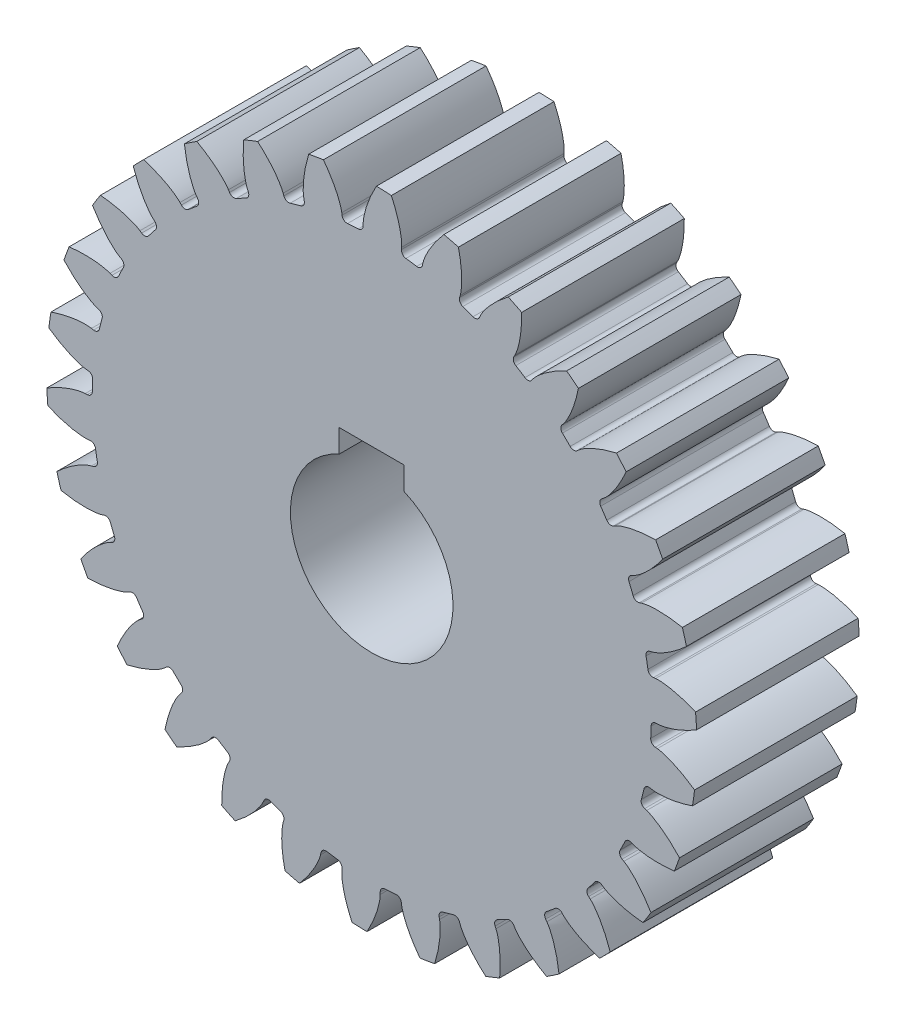
from build123d import *

# Parameters (mm, degrees)
SKETCH_1_R                       = 40
EXTRUDE_1_DEPTH                  = 20
CUT_EXTRUDE_1_DEPTH              = 61
FILLET_1_R                       = 0.625
PATTERN_CIRCULAR_1_COUNT         = 30
FILLET_1_OF_PATTERN_CIRCULAR_1_R = 0.625
CUT_EXTRUDE_2_DEPTH              = 60.97116839


with BuildPart() as part:
    # 草图1 → 凸台-拉伸1 (new body)
    with BuildSketch(Plane.XY):
        Circle(SKETCH_1_R)
    extrude(amount=EXTRUDE_1_DEPTH)

    # 草图2 → 切除-拉伸1 (cut, through all)
    with BuildSketch(Plane(origin=(0, 0, 0), x_dir=(-1, 0, 0), z_dir=(0, 0, -1))):
        with BuildLine():
            Line((-35.238473279, 0), (-34.374995165, -0.018231187))
            ThreePointArc((-34.374995165, -0.018231187), (-34.350890182, -1.287232965), (-34.279954168, -2.554479841))
            Line((-34.279954168, -2.554479841), (-35.139646197, -2.637283486))
            add(Edge.make_bspline(
                [(-35.139646197, -2.637283486), (-35.165583876, -2.639781746), (-35.238148262, -2.64849253), (-35.374524812, -2.671641963), (-35.595423661, -2.718865499), (-35.874105652, -2.792799504), (-36.230455076, -2.9040601), (-36.644621455, -3.055040806), (-37.093151943, -3.241691998), (-37.573073419, -3.466609592), (-38.04426973, -3.710342163), (-38.506447974, -3.970769709), (-38.959752886, -4.246290712), (-39.31743129, -4.479128313), (-39.560427626, -4.644854401), (-39.692816711, -4.737382216), (-39.716488956, -4.753998843)],
                knots=[0, 0, 0, 0, 0, 0.005376748, 0.015083688, 0.02853182, 0.046610139, 0.064854849, 0.092110525, 0.119476175, 0.146842495, 0.174208853, 0.201574955, 0.228941013, 0.256307345, 0.26227653, 0.26227653, 0.26227653, 0.26227653, 0.26227653], degree=4))
            ThreePointArc((-39.716488956, -4.753998843), (-39.971944939, -1.497871087), (-39.960897329, 1.768243375))
            add(Edge.make_bspline(
                [(-35.238473279, 0), (-35.264525188, 0.000550051), (-35.33753799, 0.003805612), (-35.475264596, 0.016683561), (-35.699078187, 0.047242362), (-35.982511904, 0.100112171), (-36.346188796, 0.184391177), (-36.770493187, 0.303951819), (-37.231734928, 0.456511062), (-37.727143517, 0.644880053), (-38.215259543, 0.852664256), (-38.695632262, 1.077771533), (-39.168286145, 1.318594026), (-39.542387237, 1.524009611), (-39.797105195, 1.671084821), (-39.936047869, 1.753445005), (-39.960897329, 1.768243375)],
                knots=[0, 0, 0, 0, 0, 0.005376748, 0.015083688, 0.02853182, 0.046610139, 0.064854849, 0.092110525, 0.119476175, 0.146842495, 0.174208853, 0.201574955, 0.228941013, 0.256307345, 0.26227653, 0.26227653, 0.26227653, 0.26227653, 0.26227653], degree=4))
        make_face()
    cut_extrude_1 = extrude(amount=-CUT_EXTRUDE_1_DEPTH, mode=Mode.SUBTRACT)

    # 圆角1
    fillet_1_edges = [part.edges().sort_by_distance(p)[0] for p in [
        (34.374995165, -0.018231187, 10),
        (34.279954168, -2.554479841, 10),
    ]]
    fillet(fillet_1_edges, radius=FILLET_1_R)

    # 阵列(圆周)1: 切除-拉伸1 ×30 about axis
    pattern_circular_1_axis = Axis((0, 0, 20), (0, 0, -1))
    for i in range(1, PATTERN_CIRCULAR_1_COUNT):
        add(cut_extrude_1.rotate(pattern_circular_1_axis, i * 360 / PATTERN_CIRCULAR_1_COUNT), mode=Mode.SUBTRACT)

    # 圆角1 of 阵列(圆周)1
    fillet_1_of_pattern_circular_1_edges = [part.edges().sort_by_distance(p)[0] for p in [
        (33.620028569, -7.164796159, 10),
        (32.9997487, -9.625861559, 10),
        (31.395705398, -13.998225158, 10),
        (30.277295863, -16.276546938, 10),
        (27.799239247, -20.219864546, 10),
        (26.23157991, -22.215869112, 10),
        (22.987812946, -25.557798828, 10),
        (21.039418043, -27.184251202, 10),
        (17.171708911, -29.778734662, 10),
        (14.927732648, -30.96455107, 10),
        (10.605118798, -32.698196896, 10),
        (8.163633706, -33.391551472, 10),
        (3.575034105, -34.188591023, 10),
        (1.042744797, -34.359180844, 10),
        (-3.611296734, -34.184779667, 10),
        (-6.123717063, -33.82514914, 10),
        (-10.639796577, -32.686929403, 10),
        (-13.022543102, -31.812796107, 10),
        (-17.203286254, -29.760503475, 10),
        (-19.352221519, -28.410071229, 10),
        (-23.014909771, -25.533400738, 10),
        (-24.836114994, -23.765689913, 10),
        (-27.820671293, -20.190365866, 10),
        (-29.234551066, -18.082633906, 10),
        (-31.410535982, -13.964915121, 10),
        (-32.355296973, -11.609280028, 10),
        (-33.627609523, -7.129130575, 10),
        (-34.061961145, -4.628544905, 10),
        (-34.374995165, 0.018231187, 10),
        (-34.279954168, 2.554479841, 10),
        (-33.620028569, 7.164796159, 10),
        (-32.9997487, 9.625861559, 10),
        (-31.395705398, 13.998225158, 10),
        (-30.277295863, 16.276546938, 10),
        (-27.799239247, 20.219864546, 10),
        (-26.23157991, 22.215869112, 10),
        (-22.987812946, 25.557798828, 10),
        (-21.039418043, 27.184251202, 10),
        (-17.171708911, 29.778734662, 10),
        (-14.927732648, 30.96455107, 10),
        (-10.605118798, 32.698196896, 10),
        (-8.163633706, 33.391551472, 10),
        (-3.575034105, 34.188591023, 10),
        (-1.042744797, 34.359180844, 10),
        (3.611296734, 34.184779667, 10),
        (6.123717063, 33.82514914, 10),
        (10.639796577, 32.686929403, 10),
        (13.022543102, 31.812796107, 10),
        (17.203286254, 29.760503475, 10),
        (19.352221519, 28.410071229, 10),
        (23.014909771, 25.533400738, 10),
        (24.836114994, 23.765689913, 10),
        (27.820671293, 20.190365866, 10),
        (29.234551066, 18.082633906, 10),
        (31.410535982, 13.964915121, 10),
        (32.355296973, 11.609280028, 10),
        (33.627609523, 7.129130575, 10),
        (34.061961145, 4.628544905, 10),
    ]]
    fillet(fillet_1_of_pattern_circular_1_edges, radius=FILLET_1_OF_PATTERN_CIRCULAR_1_R)

    # 草图3 → 切除-拉伸2 (cut, through all)
    with BuildSketch(Plane(origin=(0, 0, 0), x_dir=(-1, 0, 0), z_dir=(0, 0, -1))):
        with BuildLine():
            Line((-4, 9.16515139), (-4, 12))
            Line((-4, 12), (4, 12))
            Line((4, 12), (4, 9.16515139))
            ThreePointArc((4, 9.16515139), (0, -10), (-4, 9.16515139))
        make_face()
    extrude(amount=-CUT_EXTRUDE_2_DEPTH, mode=Mode.SUBTRACT)


solid = part.part
